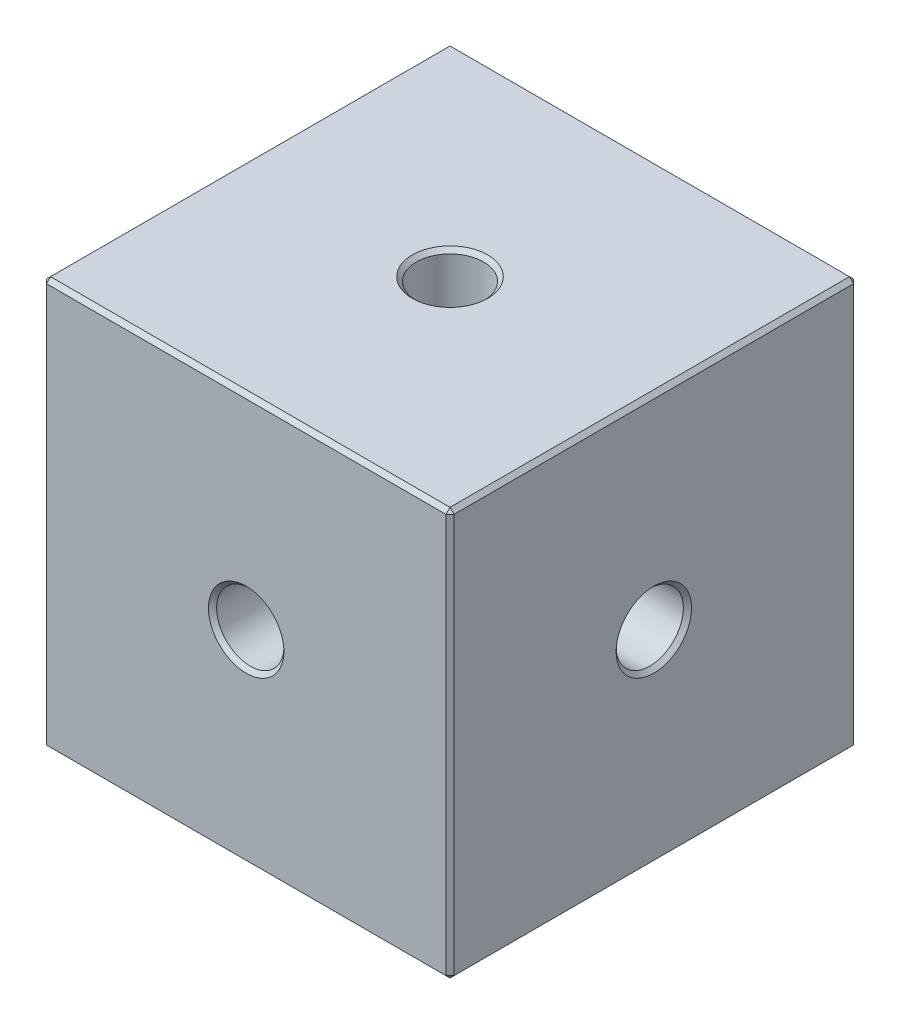
from build123d import *

# Parameters (mm, degrees)
SKETCH_1_W         = 20
SKETCH_1_H         = 20
EXTRUDE_1_DEPTH    = 10
HOLE_WIZARD_M4_1_D = 3.3
HOLE_WIZARD_M4_2_D = 3.3
HOLE_WIZARD_M4_3_D = 3.3
CHAMFER_1_SIZE     = 0.2


with BuildPart() as part:
    # 草图1 → 凸台-拉伸1 (new, symmetric)
    with BuildSketch(Plane(origin=(0, 0, 0), x_dir=(1, 0, 0), z_dir=(0, 1, 0))):
        Rectangle(SKETCH_1_W, SKETCH_1_H)
    extrude(amount=EXTRUDE_1_DEPTH, both=True)

    # M4 螺纹孔1 (through all)
    with Locations(Plane.XY.offset(10)):
        with Locations((0, 0)):
            Hole(HOLE_WIZARD_M4_1_D / 2)

    # M4 螺纹孔2 (through all)
    with Locations(Plane(origin=(0, 10, 0), x_dir=(1, 0, 0), z_dir=(0, 1, 0))):
        with Locations((0, 0)):
            Hole(HOLE_WIZARD_M4_2_D / 2)

    # M4 螺纹孔3 (through all)
    with Locations(Plane(origin=(10, 0, 0), x_dir=(0, 0, -1), z_dir=(1, 0, 0))):
        with Locations((0, 0)):
            Hole(HOLE_WIZARD_M4_3_D / 2)

    # 倒角1
    chamfer_1_edges = [part.edges().sort_by_distance(p)[0] for p in [
        (-10, 10, 0),
        (1.65, 0, 10),
        (1.65, 0, -10),
        (0, 10, 10),
        (1.65, -10, 0),
        (1.65, 10, 0),
        (-10, 0, -1.65),
        (10, 0, -1.65),
        (10, 10, 0),
        (0, -10, 10),
        (-10, -10, 0),
        (0, -10, -10),
        (10, -10, 0),
        (10, 0, 10),
        (-10, 0, 10),
        (-10, 0, -10),
        (10, 0, -10),
        (0, 10, -10),
    ]]
    chamfer(chamfer_1_edges, length=CHAMFER_1_SIZE)


solid = part.part
